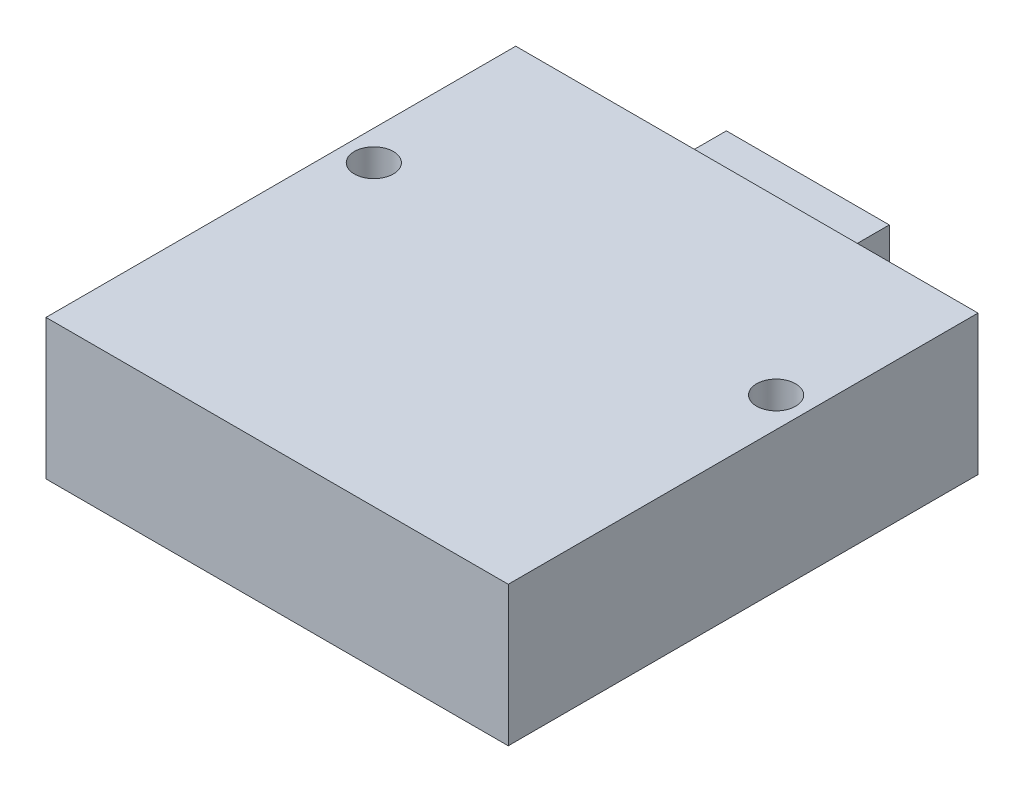
from build123d import *

# Parameters (mm, degrees)
SKETCH1_W                        = 117.475
SKETCH1_H                        = 35.56
EXTRUDE1_DEPTH                   = 119.38
SKETCH2_W                        = 41.402
SKETCH2_H                        = 20.828
EXTRUDE2_DEPTH                   = 15.494
F_25_64_0_39063_DIAMETER_HOLE1_D = 9.922002


with BuildPart() as part:
    # Sketch1 → Extrude1 (new body)
    with BuildSketch(Plane.XY):
        Rectangle(SKETCH1_W, SKETCH1_H)
    extrude(amount=EXTRUDE1_DEPTH)

    # Sketch2 → Extrude2 (add)
    with BuildSketch(Plane(origin=(0, 0, 0), x_dir=(-1, 0, 0), z_dir=(0, 0, -1))):
        Rectangle(SKETCH2_W, SKETCH2_H)
    extrude(amount=EXTRUDE2_DEPTH)

    # 25/64 (0.39063) Diameter Hole1 (through all)
    with Locations(Plane(origin=(-51.1175, -17.78, 43.688), x_dir=(0, 0, -1), z_dir=(0, -1, 0))):
        with Locations((0, 0), (0, 102.235)):
            Hole(F_25_64_0_39063_DIAMETER_HOLE1_D / 2)


solid = part.part
